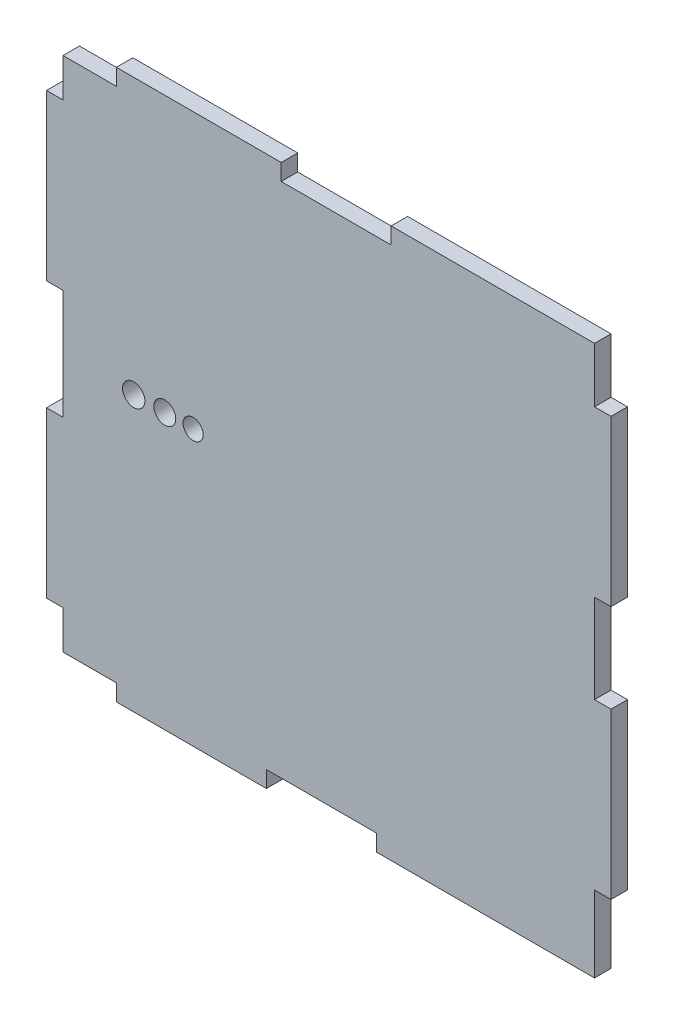
from build123d import *

# Parameters (mm, degrees)
ESQUISSE1_R        = 2.033472286
ESQUISSE1_R_2      = 1.995646952
ESQUISSE1_R_3      = 1.82934304
BOSS_EXTRU_1_DEPTH = 3


with BuildPart() as part:
    # Esquisse1 → Boss.-Extru.1 (new body)
    with BuildSketch(Plane.XY):
        Polygon((-54.518120274, -33.413932292), (-57.518120274, -33.413932292), (-57.518120274, -63.413932292), (-54.518120274, -63.413932292), (-54.518120274, -70.413932292), (-44.818120274, -70.413932292), (-44.818120274, -73.413932292), (-17.518120274, -73.413932292), (-17.518120274, -70.413932292), (2.481879726, -70.413932292), (2.481879726, -73.413932292), (32.481879726, -73.413932292), (42.181879726, -73.413932292), (42.181879726, -59.550988322), (45.181879726, -59.550988322), (45.181879726, -29.550988322), (42.181879726, -29.550988322), (42.181879726, -13.413932292), (45.181879726, -13.413932292), (45.181879726, 16.586067708), (42.181879726, 16.586067708), (42.181879726, 26.586067708), (29.835043292, 26.586067708), (5.181879726, 26.586067708), (5.181879726, 23.586067708), (-14.818120274, 23.586067708), (-14.818120274, 26.586067708), (-44.818120274, 26.586067708), (-44.818120274, 23.586067708), (-54.518120274, 23.586067708), (-54.518120274, 16.586067708), (-57.518120274, 16.586067708), (-57.518120274, -13.413932292), (-54.518120274, -13.413932292), align=None)
        with Locations((-41.652875269, -23.413932292)):
            Circle(ESQUISSE1_R, mode=Mode.SUBTRACT)
        with Locations((-35.998542238, -23.413932292)):
            Circle(ESQUISSE1_R_2, mode=Mode.SUBTRACT)
        with Locations((-30.843120944, -23.413932292)):
            Circle(ESQUISSE1_R_3, mode=Mode.SUBTRACT)
    extrude(amount=BOSS_EXTRU_1_DEPTH)


solid = part.part
